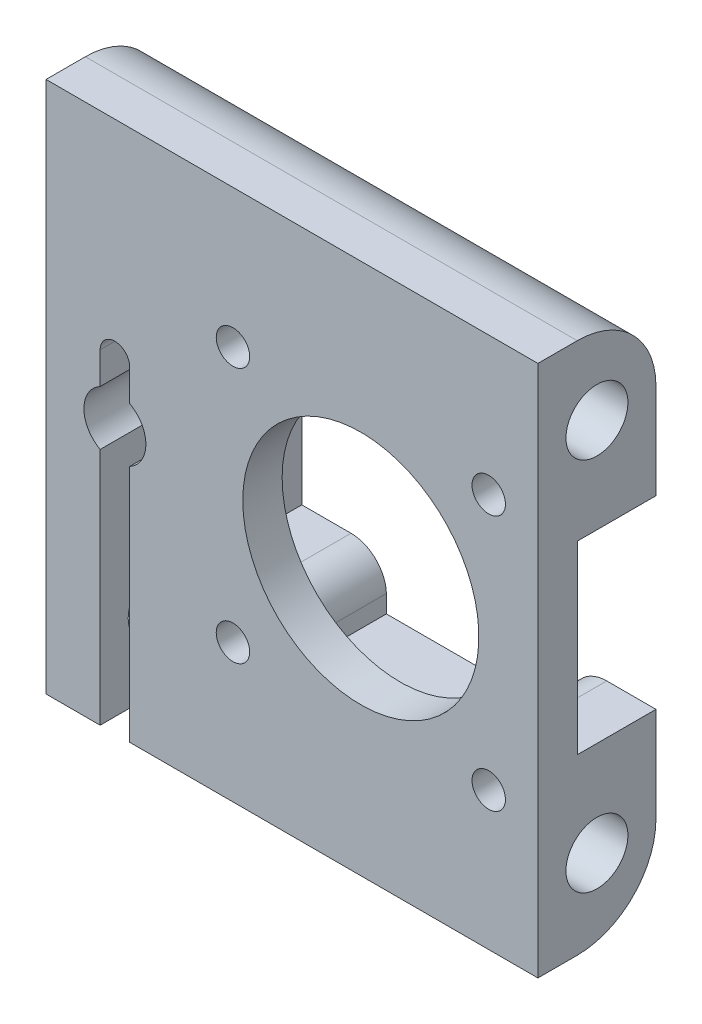
from build123d import *

# Parameters (mm, degrees)
SKETCH1_W           = 50
SKETCH1_H           = 54.105
BOSS_EXTRUDE1_DEPTH = 12
SKETCH2_R           = 3.15
CUT_EXTRUDE1_DEPTH  = 75.641483272
FILLET1_R           = 8
SKETCH3_R           = 12
SKETCH3_R_2         = 1.7
CUT_EXTRUDE2_DEPTH  = 75.641483272
CUT_EXTRUDE4_DEPTH  = 8


with BuildPart() as part:
    # Sketch1 → Boss-Extrude1 (new body)
    with BuildSketch(Plane.XY):
        with Locations((25, 27.0525)):
            Rectangle(SKETCH1_W, SKETCH1_H)
    extrude(amount=BOSS_EXTRUDE1_DEPTH)

    # Sketch2 → Cut-Extrude1 (cut, through all)
    with BuildSketch(Plane(origin=(0, 0, 0), x_dir=(0, 0, -1), z_dir=(1, 0, 0))):
        with Locations((-6, 46.105)):
            Circle(SKETCH2_R)
        with Locations(Location((-6, 8, 0), (0, 0, 180))):
            Circle(SKETCH2_R)
    extrude(amount=CUT_EXTRUDE1_DEPTH, mode=Mode.SUBTRACT)

    # Fillet1
    fillet1_edges = [part.edges().sort_by_distance(p)[0] for p in [
        (25, 54.105, 0),
        (25, 0, 0),
    ]]
    fillet(fillet1_edges, radius=FILLET1_R)

    # Sketch3 → Cut-Extrude2 (cut, through all)
    with BuildSketch(Plane(origin=(0, 0, 0), x_dir=(-1, 0, 0), z_dir=(0, 0, -1))):
        with Locations((-32, 27.0525)):
            Circle(SKETCH3_R)
        with Locations((-19, 40.0525)):
            Circle(SKETCH3_R_2)
        with Locations((-19, 14.0525)):
            Circle(SKETCH3_R_2)
        with Locations((-45, 14.0525)):
            Circle(SKETCH3_R_2)
        with Locations((-45, 40.0525)):
            Circle(SKETCH3_R_2)
        with BuildLine():
            Line((-8.5, 0), (-8.5, 24.282572203))
            ThreePointArc((-8.5, 24.282572203), (-10.15, 27.0525), (-8.5, 29.822427797))
            Line((-8.5, 29.822427797), (-8.5, 33.0525))
            ThreePointArc((-8.5, 33.0525), (-7, 34.5525), (-5.5, 33.0525))
            Line((-5.5, 33.0525), (-5.5, 29.822427797))
            ThreePointArc((-5.5, 29.822427797), (-3.85, 27.0525), (-5.5, 24.282572203))
            Line((-5.5, 24.282572203), (-5.5, 0))
            Line((-5.5, 0), (-8.5, 0))
        make_face()
    extrude(amount=-CUT_EXTRUDE2_DEPTH, mode=Mode.SUBTRACT)

    # Sketch5 → Cut-Extrude4 (cut)
    with BuildSketch(Plane(origin=(0, 0, 0), x_dir=(-1, 0, 0), z_dir=(0, 0, -1))):
        with BuildLine():
            Line((-19, 17.6525), (-14, 17.6525))
            Line((-14, 17.6525), (-14, 36.4525))
            Line((-14, 36.4525), (-19, 36.4525))
            ThreePointArc((-19, 36.4525), (-21.510876341, 37.472674425), (-22.598679445, 39.955))
            Line((-22.598679445, 39.955), (-22.598679445, 41.7525))
            Line((-22.598679445, 41.7525), (-41.401320555, 41.7525))
            Line((-41.401320555, 41.7525), (-41.401320555, 39.955))
            ThreePointArc((-41.401320555, 39.955), (-42.489123659, 37.472674425), (-45, 36.4525))
            Line((-45, 36.4525), (-50, 36.4525))
            Line((-50, 36.4525), (-50, 17.6525))
            Line((-50, 17.6525), (-45, 17.6525))
            ThreePointArc((-45, 17.6525), (-42.489123659, 16.632325575), (-41.401320555, 14.15))
            Line((-41.401320555, 14.15), (-41.401320555, 12.3525))
            Line((-41.401320555, 12.3525), (-22.598679445, 12.3525))
            Line((-22.598679445, 12.3525), (-22.598679445, 14.15))
            ThreePointArc((-22.598679445, 14.15), (-21.510876341, 16.632325575), (-19, 17.6525))
        make_face()
    extrude(amount=-CUT_EXTRUDE4_DEPTH, mode=Mode.SUBTRACT)


solid = part.part
